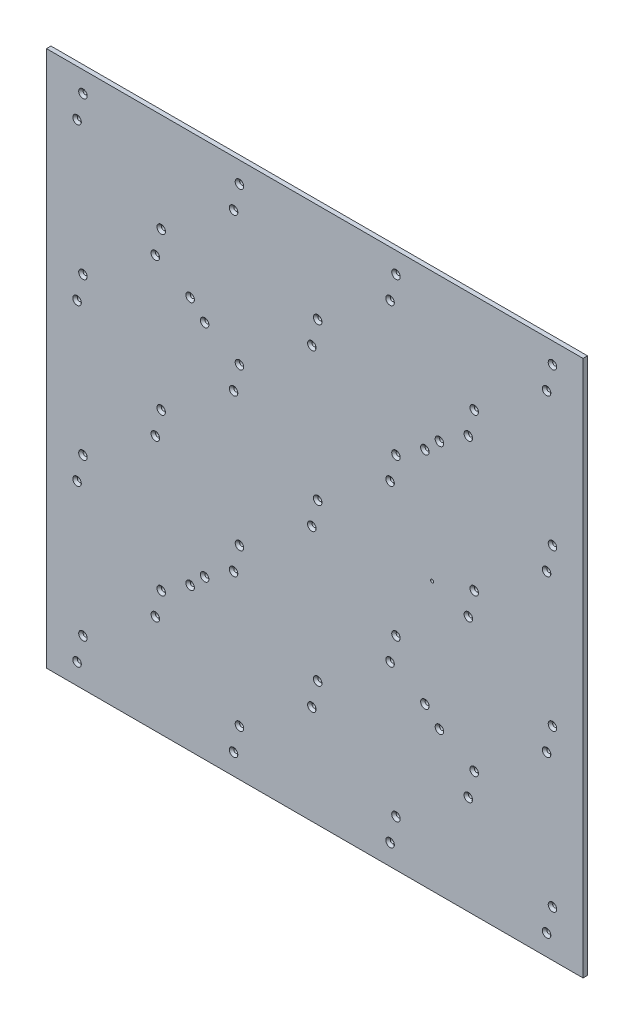
from build123d import *

# Parameters (mm, degrees)
BOSS_EXTRUDE1_START = 3
SKETCH1_W           = 1200
SKETCH1_H           = 1200
BOSS_EXTRUDE1_DEPTH = 10
SKETCH2_R           = 4.5
CUT_EXTRUDE1_DEPTH  = 849.587060943
CHAMFER1_SIZE       = 5
CUT_EXTRUDE2_REACH  = 850.587
SKETCH3_R           = 3.4


with BuildPart() as part:
    # Sketch1 → Boss-Extrude1 (new body)
    with BuildSketch(Plane.XY.offset(BOSS_EXTRUDE1_START)):
        Rectangle(SKETCH1_W, SKETCH1_H)
    extrude(amount=-BOSS_EXTRUDE1_DEPTH)

    # Sketch2 → Cut-Extrude1 (cut, through all)
    with BuildSketch(Plane(origin=(0, 0, -7), x_dir=(-1, 0, 0), z_dir=(0, 0, -1))):
        with Locations((-278.749982464, 278.776929471)):
            Circle(SKETCH2_R)
        with Locations(Location((-246.223070529, 246.250017536, 0), (0, 0, 180))):
            Circle(SKETCH2_R)
        with Locations(Location((246.250017536, 246.223070529, 0), (0, 0, 180))):
            Circle(SKETCH2_R)
        with Locations((278.776929471, 278.749982464)):
            Circle(SKETCH2_R)
        with Locations(Location((246.223070529, -246.250017536, 0), (0, 0, 180))):
            Circle(SKETCH2_R)
        with Locations((278.749982464, -278.776929471)):
            Circle(SKETCH2_R)
        with Locations(Location((-246.250017536, -246.223070529, 0), (0, 0, 180))):
            Circle(SKETCH2_R)
        with Locations((-278.776929471, -278.749982464)):
            Circle(SKETCH2_R)
        with Locations((-531.581664893, 553.513118765)):
            Circle(SKETCH2_R)
        with Locations((-518.429478763, 496.520312201)):
            Circle(SKETCH2_R)
        with Locations((-531.581664893, 203.509404213)):
            Circle(SKETCH2_R)
        with Locations((-518.429478763, 146.516597649)):
            Circle(SKETCH2_R)
        with Locations((-343.427621487, 321.518454925)):
            Circle(SKETCH2_R)
        with Locations((-356.579807617, 378.511261489)):
            Circle(SKETCH2_R)
        with Locations((-181.577950341, 553.513118765)):
            Circle(SKETCH2_R)
        with Locations((-168.425764211, 496.520312201)):
            Circle(SKETCH2_R)
        with Locations((168.425764211, 553.513118765)):
            Circle(SKETCH2_R)
        with Locations((181.577950341, 496.520312201)):
            Circle(SKETCH2_R)
        with Locations((-6.576093065, 378.511261489)):
            Circle(SKETCH2_R)
        with Locations((6.576093065, 321.518454925)):
            Circle(SKETCH2_R)
        with Locations((-181.577950341, 203.509404213)):
            Circle(SKETCH2_R)
        with Locations((-168.425764211, 146.516597649)):
            Circle(SKETCH2_R)
        with Locations((-356.579807617, 28.507546937)):
            Circle(SKETCH2_R)
        with Locations((-343.427621487, -28.485259627)):
            Circle(SKETCH2_R)
        with Locations((-518.429478763, -203.487116903)):
            Circle(SKETCH2_R)
        with Locations((-531.581664893, -146.494310339)):
            Circle(SKETCH2_R)
        with Locations((-531.581664893, -496.498024891)):
            Circle(SKETCH2_R)
        with Locations((-518.429478763, -553.490831454)):
            Circle(SKETCH2_R)
        with Locations((-356.579807617, -321.496167615)):
            Circle(SKETCH2_R)
        with Locations((-343.427621487, -378.488974178)):
            Circle(SKETCH2_R)
        with Locations((-181.577950341, -146.494310339)):
            Circle(SKETCH2_R)
        with Locations((-168.425764211, -203.487116903)):
            Circle(SKETCH2_R)
        with Locations((-6.576093065, 28.507546937)):
            Circle(SKETCH2_R)
        with Locations((6.576093065, -28.485259627)):
            Circle(SKETCH2_R)
        with Locations((168.425764211, 203.509404213)):
            Circle(SKETCH2_R)
        with Locations((181.577950341, 146.516597649)):
            Circle(SKETCH2_R)
        with Locations((343.427621487, 378.511261489)):
            Circle(SKETCH2_R)
        with Locations((356.579807617, 321.518454925)):
            Circle(SKETCH2_R)
        with Locations((518.429478763, 553.513118765)):
            Circle(SKETCH2_R)
        with Locations((531.581664893, 496.520312201)):
            Circle(SKETCH2_R)
        with Locations((-181.577950341, -496.498024891)):
            Circle(SKETCH2_R)
        with Locations((-168.425764211, -553.490831454)):
            Circle(SKETCH2_R)
        with Locations((-6.576093065, -321.496167615)):
            Circle(SKETCH2_R)
        with Locations((6.576093065, -378.488974178)):
            Circle(SKETCH2_R)
        with Locations((168.425764211, -146.494310339)):
            Circle(SKETCH2_R)
        with Locations((181.577950341, -203.487116903)):
            Circle(SKETCH2_R)
        with Locations((343.427621487, 28.507546937)):
            Circle(SKETCH2_R)
        with Locations((356.579807617, -28.485259627)):
            Circle(SKETCH2_R)
        with Locations((518.429478763, 203.509404213)):
            Circle(SKETCH2_R)
        with Locations((531.581664893, 146.516597649)):
            Circle(SKETCH2_R)
        with Locations((168.425764211, -496.498024891)):
            Circle(SKETCH2_R)
        with Locations((181.577950341, -553.490831454)):
            Circle(SKETCH2_R)
        with Locations((343.427621487, -321.496167615)):
            Circle(SKETCH2_R)
        with Locations((356.579807617, -378.488974178)):
            Circle(SKETCH2_R)
        with Locations((531.581664893, -203.487116903)):
            Circle(SKETCH2_R)
        with Locations((518.429478763, -146.494310339)):
            Circle(SKETCH2_R)
        with Locations((518.429478763, -496.498024891)):
            Circle(SKETCH2_R)
        with Locations((531.581664893, -553.490831454)):
            Circle(SKETCH2_R)
    extrude(amount=-CUT_EXTRUDE1_DEPTH, mode=Mode.SUBTRACT)

    # Chamfer1
    chamfer1_edges = [part.edges().sort_by_distance(p)[0] for p in [
        (522.929478763, -553.490831454, 3),
        (361.079807617, -321.496167615, 3),
        (347.927621487, -378.488974178, 3),
        (186.077950341, -146.494310339, 3),
        (172.925764211, -203.487116903, 3),
        (11.076093065, 28.507546937, 3),
        (536.081664893, 553.513118765, 3),
        (283.276929471, -278.749982464, 3),
        (241.750017536, -246.223070529, 3),
        (-274.249982464, -278.776929471, 3),
        (283.249982464, 278.776929471, 3),
        (-250.750017536, 246.223070529, 3),
        (-274.276929471, 278.749982464, 3),
        (-250.723070529, -246.250017536, 3),
        (-163.925764211, 553.513118765, 3),
        (172.925764211, 496.520312201, 3),
        (186.077950341, 553.513118765, 3),
        (361.079807617, 378.511261489, 3),
        (522.929478763, 496.520312201, 3),
        (536.081664893, 203.509404213, 3),
        (522.929478763, 146.516597649, 3),
        (347.927621487, 321.518454925, 3),
        (-352.079807617, -378.488974178, 3),
        (-527.081664893, -203.487116903, 3),
        (-513.929478763, -146.494310339, 3),
        (-513.929478763, -496.498024891, 3),
        (-527.081664893, 146.516597649, 3),
        (-163.925764211, -496.498024891, 3),
        (-177.077950341, -553.490831454, 3),
        (-338.927621487, -321.496167615, 3),
        (-527.081664893, -553.490831454, 3),
        (-352.079807617, 321.518454925, 3),
        (-513.929478763, 553.513118765, 3),
        (-527.081664893, 496.520312201, 3),
        (186.077950341, -496.498024891, 3),
        (-338.927621487, 378.511261489, 3),
        (-177.077950341, 146.516597649, 3),
        (-163.925764211, 203.509404213, 3),
        (-2.076093065, -28.485259627, 3),
        (172.925764211, -553.490831454, 3),
        (11.076093065, -321.496167615, 3),
        (-2.076093065, -378.488974178, 3),
        (-163.925764211, -146.494310339, 3),
        (-177.077950341, -203.487116903, 3),
        (-338.927621487, 28.507546937, 3),
        (-352.079807617, -28.485259627, 3),
        (-513.929478763, 203.509404213, 3),
        (241.723070529, 246.250017536, 3),
        (-177.077950341, 496.520312201, 3),
        (11.076093065, 378.511261489, 3),
        (-2.076093065, 321.518454925, 3),
        (186.077950341, 203.509404213, 3),
        (172.925764211, 146.516597649, 3),
        (361.079807617, 28.507546937, 3),
        (347.927621487, -28.485259627, 3),
        (522.929478763, -203.487116903, 3),
        (536.081664893, -146.494310339, 3),
        (536.081664893, -496.498024891, 3),
    ]]
    chamfer(chamfer1_edges, length=CHAMFER1_SIZE)

    # Sketch3 → Cut-Extrude2 (cut, up to next)
    with BuildSketch(Plane(origin=(0, 0, -7), x_dir=(-1, 0, 0), z_dir=(0, 0, -1)), mode=Mode.PRIVATE) as cut_extrude2_sk1:
        with Locations((-262.5, 0)):
            Circle(SKETCH3_R)
    cut_extrude2_tool1 = extrude(cut_extrude2_sk1.sketch, amount=-CUT_EXTRUDE2_REACH, mode=Mode.PRIVATE) & part.part
    add(cut_extrude2_tool1.solids().sort_by_distance((262.5, 0, -7))[0], mode=Mode.SUBTRACT)


solid = part.part
